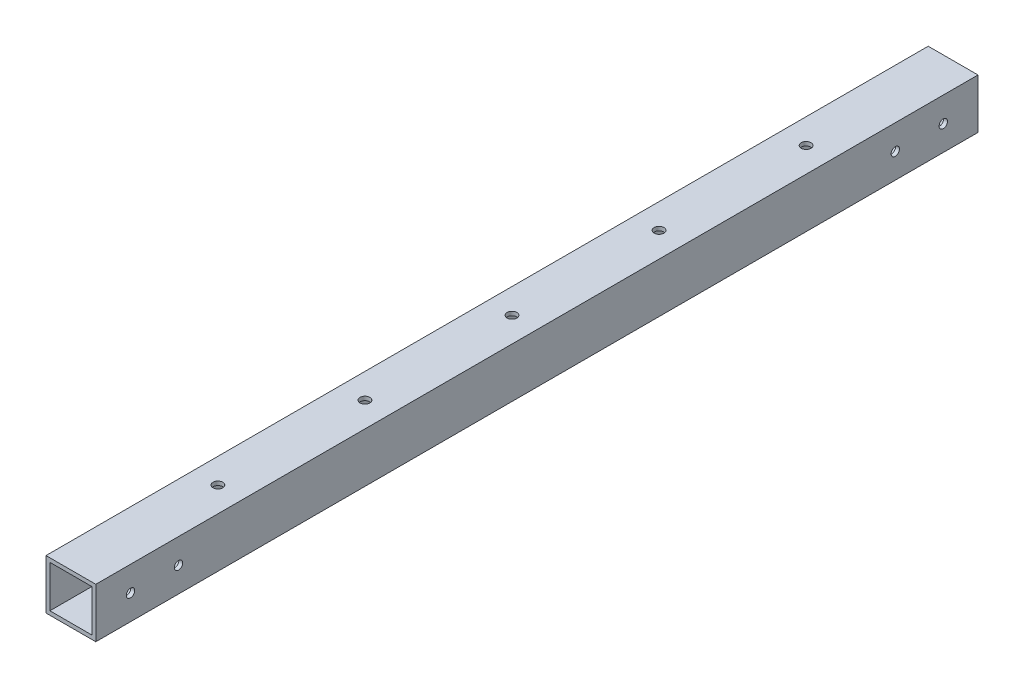
from build123d import *

# Parameters (mm, degrees)
SKETCH_1_W          = 25.4
SKETCH_1_H          = 25.4
EXTRUDE_1_DEPTH     = 450
SKETCH_1_3_W        = 21.4
SKETCH_1_3_H        = 21.4
CUT_EXTRUDE_1_DEPTH = 451.358279595
SKETCH_2_R          = 2.15
CUT_EXTRUDE_2_DEPTH = 3
SKETCH_3_R          = 2.15
CUT_EXTRUDE_3_DEPTH = 3
SKETCH_4_R          = 2.15
CUT_EXTRUDE_4_DEPTH = 3
SKETCH_5_R          = 2.15
CUT_EXTRUDE_5_DEPTH = 3
SKETCH_6_R          = 2.5
CUT_EXTRUDE_6_DEPTH = 10
SKETCH_8_R          = 2.5
CUT_EXTRUDE_7_DEPTH = 10


with BuildPart() as part:
    # 草圖1 → 填料-伸長1 (new body)
    with BuildSketch(Plane.XY):
        Rectangle(SKETCH_1_W, SKETCH_1_H)
    extrude(amount=EXTRUDE_1_DEPTH)

    # 草圖1<3> → 除料-伸長1 (cut, through all)
    with BuildSketch(Plane.XY):
        Rectangle(SKETCH_1_3_W, SKETCH_1_3_H)
    extrude(amount=CUT_EXTRUDE_1_DEPTH, mode=Mode.SUBTRACT)

    # 草圖2 → 除料-伸長2 (cut)
    with BuildSketch(Plane.XZ.offset(12.7)):
        with Locations((0, 17.7)):
            Circle(SKETCH_2_R)
        with Locations((0, 42.2)):
            Circle(SKETCH_2_R)
    extrude(amount=-CUT_EXTRUDE_2_DEPTH, mode=Mode.SUBTRACT)

    # 草圖3 → 除料-伸長3 (cut)
    with BuildSketch(Plane(origin=(12.7, 0, 0), x_dir=(0, 0, -1), z_dir=(1, 0, 0))):
        with Locations((-42.2, 0)):
            Circle(SKETCH_3_R)
        with Locations((-17.7, 0)):
            Circle(SKETCH_3_R)
    extrude(amount=-CUT_EXTRUDE_3_DEPTH, mode=Mode.SUBTRACT)

    # 草圖4 → 除料-伸長4 (cut)
    with BuildSketch(Plane(origin=(12.7, 0, 0), x_dir=(0, 0, -1), z_dir=(1, 0, 0))):
        with Locations((-407.8, 0)):
            Circle(SKETCH_4_R)
        with Locations((-432.3, 0)):
            Circle(SKETCH_4_R)
    extrude(amount=-CUT_EXTRUDE_4_DEPTH, mode=Mode.SUBTRACT)

    # 草圖5 → 除料-伸長5 (cut)
    with BuildSketch(Plane.XZ.offset(12.7)):
        with Locations((0, 407.8)):
            Circle(SKETCH_5_R)
        with Locations((0, 432.3)):
            Circle(SKETCH_5_R)
    extrude(amount=-CUT_EXTRUDE_5_DEPTH, mode=Mode.SUBTRACT)

    # 草圖6 → 除料-伸長6 (cut)
    with BuildSketch(Plane(origin=(0, 12.7, 0), x_dir=(1, 0, 0), z_dir=(0, 1, 0))):
        with Locations((0, -375)):
            Circle(SKETCH_6_R)
        with Locations((0, -300)):
            Circle(SKETCH_6_R)
        with Locations((0, -225)):
            Circle(SKETCH_6_R)
        with Locations((0, -150)):
            Circle(SKETCH_6_R)
        with Locations((0, -75)):
            Circle(SKETCH_6_R)
    extrude(amount=-CUT_EXTRUDE_6_DEPTH, mode=Mode.SUBTRACT)

    # 草圖8 → 除料-伸長7 (cut)
    with BuildSketch(Plane.ZY.offset(12.7)):
        with Locations((375, 0)):
            Circle(SKETCH_8_R)
        with Locations((300, 0)):
            Circle(SKETCH_8_R)
        with Locations((225, 0)):
            Circle(SKETCH_8_R)
        with Locations((150, 0)):
            Circle(SKETCH_8_R)
        with Locations((75, 0)):
            Circle(SKETCH_8_R)
    extrude(amount=-CUT_EXTRUDE_7_DEPTH, mode=Mode.SUBTRACT)


solid = part.part
